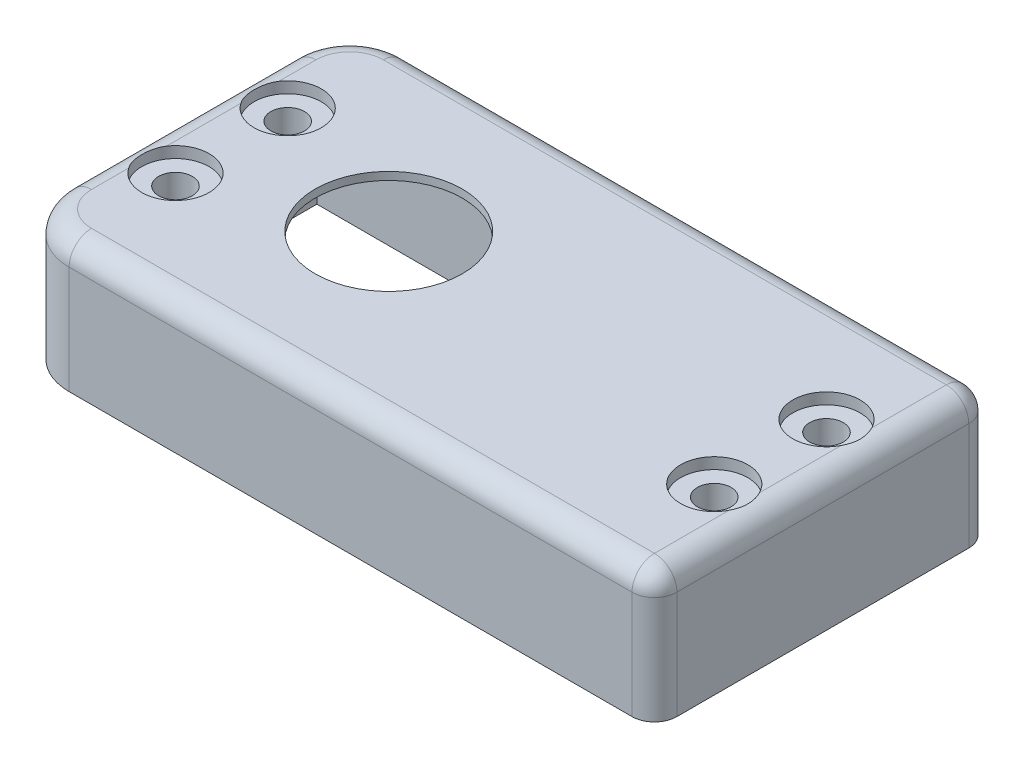
from build123d import *
from OCP.BRepFilletAPI import BRepFilletAPI_MakeChamfer

# Parameters (mm, degrees)
SKETCH1_W               = 57.15
SKETCH1_H               = 30
BOSS_EXTRUDE1_DEPTH     = 11.6
SKETCH2_W               = 54
SKETCH2_H               = 21
CUT_EXTRUDE1_DEPTH      = 10.9
SKETCH3_R               = 5.375
CUT_EXTRUDE2_DEPTH      = 0.65
FILLET1_R               = 5
CUT_EXTRUDE3_DEPTH      = 66.467740147
CUT_EXTRUDE3_DEPTH_BACK = 1.35
SKETCH5_R               = 6.55
CHAMFER1_SIZE           = 5
CHAMFER1_SIZE2          = 8.660254038
FILLET2_R               = 2
SKETCH8_R               = 1.5
CUT_EXTRUDE5_DEPTH      = 10
SKETCH9_R               = 3
CUT_EXTRUDE6_DEPTH      = 1


with BuildPart() as part:
    # Sketch1 → Boss-Extrude1 (new body)
    with BuildSketch(Plane(origin=(0, 0, 0), x_dir=(1, 0, 0), z_dir=(0, 1, 0))):
        with Locations((28.575, 15)):
            Rectangle(SKETCH1_W, SKETCH1_H)
    extrude(amount=BOSS_EXTRUDE1_DEPTH)

    # Sketch2 → Cut-Extrude1 (cut)
    with BuildSketch(Plane(origin=(0, 0, 0), x_dir=(-1, 0, 0), z_dir=(0, -1, 0))):
        with Locations((-28.575, 15)):
            Rectangle(SKETCH2_W, SKETCH2_H)
    extrude(amount=-CUT_EXTRUDE1_DEPTH, mode=Mode.SUBTRACT)

    # Sketch3 → Cut-Extrude2 (cut)
    with BuildSketch(Plane(origin=(0, 11.6, 0), x_dir=(1, 0, 0), z_dir=(0, 1, 0))):
        with Locations(Location((17.58, 15, 0), (0, 0, 270))):
            Circle(SKETCH3_R)
    extrude(amount=-CUT_EXTRUDE2_DEPTH, mode=Mode.SUBTRACT)

    # Fillet1
    fillet1_edges = [part.edges().sort_by_distance(p)[0] for p in [
        (0, 5.8, -30),
        (0, 5.8, 0),
    ]]
    fillet(fillet1_edges, radius=FILLET1_R)

    # Sketch5 → Cut-Extrude3 (cut, two sides: drawn at the far end of the back side and taken through both)
    with BuildSketch(Plane(origin=(0, 10.95, 0), x_dir=(1, 0, 0), z_dir=(0, 1, 0)).offset(-CUT_EXTRUDE3_DEPTH_BACK)):
        with Locations(Location((18.475, 15, 0), (0, 0, 90))):
            Circle(SKETCH5_R)
    extrude(amount=CUT_EXTRUDE3_DEPTH + CUT_EXTRUDE3_DEPTH_BACK, mode=Mode.SUBTRACT)

    # Chamfer1: one chamfer whose edges measure the first distance from different faces: ONE call of the kernel's chamfer builder (chamfer() names one face for all edges)
    chamfer1_edges_1 = [part.edges().sort_by_distance(p)[0] for p in [
        (1.575, 10.9, -15),
    ]]
    chamfer1_side_1 = [part.faces().sort_by_distance(p)[0] for p in [
        (1.575, 5.45, -15),
    ]]
    chamfer1_edges_2 = [part.edges().sort_by_distance(p)[0] for p in [
        (55.575, 10.9, -15),
    ]]
    chamfer1_side_2 = [part.faces().sort_by_distance(p)[0] for p in [
        (55.575, 5.45, -15),
    ]]
    chamfer1 = BRepFilletAPI_MakeChamfer(part.part.solid().wrapped)
    for e in chamfer1_edges_1:
        chamfer1.Add(CHAMFER1_SIZE, CHAMFER1_SIZE2, e.wrapped, chamfer1_side_1[0].wrapped)  # the first distance lies on this face
    for e in chamfer1_edges_2:
        chamfer1.Add(CHAMFER1_SIZE, CHAMFER1_SIZE2, e.wrapped, chamfer1_side_2[0].wrapped)  # the first distance lies on this face
    add(Compound.cast(chamfer1.Shape()), mode=Mode.REPLACE)

    # Fillet2
    fillet2_edges = [part.edges().sort_by_distance(p)[0] for p in [
        (57.15, 11.6, -15),
        (31.075, 11.6, -30),
        (0, 11.6, -15),
        (31.075, 11.6, 0),
        (1.464466094, 11.6, -1.464466094),
        (1.464466094, 11.6, -28.535533906),
        (57.15, 5.8, -30),
        (57.15, 5.8, 0),
    ]]
    fillet(fillet2_edges, radius=FILLET2_R)

    # Sketch8 → Cut-Extrude5 (cut)
    with BuildSketch(Plane(origin=(0, 11.6, 0), x_dir=(1, 0, 0), z_dir=(0, 1, 0))):
        with Locations(Location((52.475, 20, 0), (0, 0, 270))):
            Circle(SKETCH8_R)
        with Locations(Location((52.475, 10, 0), (0, 0, 270))):
            Circle(SKETCH8_R)
        with Locations(Location((4.475, 20, 0), (0, 0, 270))):
            Circle(SKETCH8_R)
        with Locations(Location((4.475, 10, 0), (0, 0, 270))):
            Circle(SKETCH8_R)
    extrude(amount=-CUT_EXTRUDE5_DEPTH, mode=Mode.SUBTRACT)

    # Sketch9 → Cut-Extrude6 (cut)
    with BuildSketch(Plane(origin=(0, 11.6, 0), x_dir=(1, 0, 0), z_dir=(0, 1, 0))):
        with Locations(Location((4.475, 20, 0), (0, 0, 270))):
            Circle(SKETCH9_R)
        with Locations(Location((4.475, 10, 0), (0, 0, 270))):
            Circle(SKETCH9_R)
        with Locations(Location((52.475, 10, 0), (0, 0, 270))):
            Circle(SKETCH9_R)
        with Locations(Location((52.475, 20, 0), (0, 0, 270))):
            Circle(SKETCH9_R)
    extrude(amount=-CUT_EXTRUDE6_DEPTH, mode=Mode.SUBTRACT)


solid = part.part
